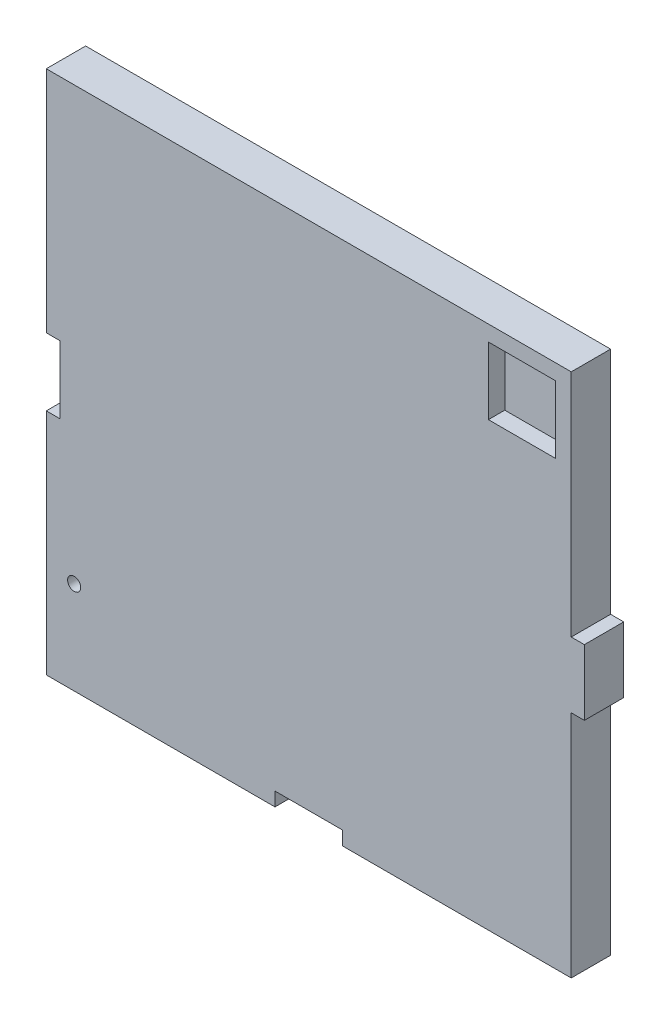
from build123d import *

# Parameters (mm, degrees)
SKETCH1_R           = 2
BOSS_EXTRUDE1_DEPTH = 12
SKETCH2_W           = 20.5
SKETCH2_H           = 20.5
CUT_EXTRUDE1_DEPTH  = 5
SKETCH4_R           = 3.45
CUT_EXTRUDE3_DEPTH  = 8


with BuildPart() as part:
    # Sketch1 → Boss-Extrude1 (new body)
    with BuildSketch(Plane.XY):
        Polygon((0, 0), (69.7, 0), (69.7, 4.2), (90.3, 4.2), (90.3, 0), (160, 0), (160, 70), (164, 70), (164, 90), (160, 90), (160, 160), (90, 160), (70, 160), (0, 160), (0, 90.3), (4.2, 90.3), (4.2, 69.7), (0, 69.7), align=None)
        with Locations((8.5, 28.3)):
            Circle(SKETCH1_R, mode=Mode.SUBTRACT)
    extrude(amount=BOSS_EXTRUDE1_DEPTH)

    # Sketch2 → Cut-Extrude1 (cut)
    with BuildSketch(Plane.XY.offset(12)):
        with Locations((145, 145)):
            Rectangle(SKETCH2_W, SKETCH2_H)
    extrude(amount=-CUT_EXTRUDE1_DEPTH, mode=Mode.SUBTRACT)

    # Sketch4 → Cut-Extrude3 (cut)
    with BuildSketch(Plane(origin=(0, 0, 0), x_dir=(-1, 0, 0), z_dir=(0, 0, -1))):
        with Locations((-8.5, 28.3)):
            Circle(SKETCH4_R)
    extrude(amount=-CUT_EXTRUDE3_DEPTH, mode=Mode.SUBTRACT)


solid = part.part
